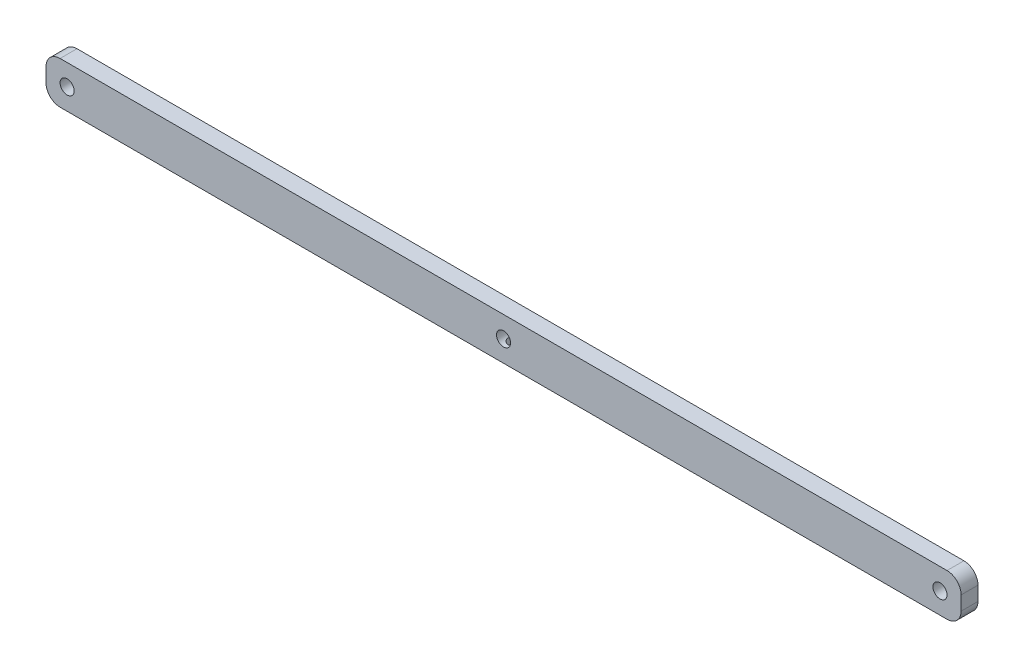
from build123d import *

# Parameters (mm, degrees)
SZKIC1_W                       = 325
SZKIC1_H                       = 15
SZKIC1_R                       = 2.5
DODANIE_WYCI_GNI_CIE1_DEPTH    = 3
ZAOKR_GLENIE1_R                = 5
OTWORY_USTALAJ_CE_3_0MM1_D     = 3
OTWORY_USTALAJ_CE_3_0MM1_DEPTH = 7.499
OTWORY_USTALAJ_CE_3_0MM1_TIP   = 0.901290929


with BuildPart() as part:
    # Szkic1 → Dodanie-wyciągnięcie1 (new, symmetric)
    with BuildSketch(Plane.XY):
        Rectangle(SZKIC1_W, SZKIC1_H)
        with Locations((155, 0)):
            Circle(SZKIC1_R, mode=Mode.SUBTRACT)
        with Locations((-155, 0)):
            Circle(SZKIC1_R, mode=Mode.SUBTRACT)
        Circle(SZKIC1_R, mode=Mode.SUBTRACT)
    extrude(amount=DODANIE_WYCI_GNI_CIE1_DEPTH, both=True)

    # Zaokrąglenie1
    zaokr_glenie1_edges = [part.edges().sort_by_distance(p)[0] for p in [
        (162.5, 7.5, 0),
        (162.5, -7.5, 0),
        (-162.5, -7.5, 0),
        (-162.5, 7.5, 0),
    ]]
    fillet(zaokr_glenie1_edges, radius=ZAOKR_GLENIE1_R)

    # Otwory ustalające Ø3.0mm1
    with Locations(Plane(origin=(0, -7.5, 0), x_dir=(-1, 0, 0), z_dir=(0, -1, 0))):
        with Locations((0, 0)):
            Hole(OTWORY_USTALAJ_CE_3_0MM1_D / 2, depth=OTWORY_USTALAJ_CE_3_0MM1_DEPTH)
            with Locations((0, 0, -(OTWORY_USTALAJ_CE_3_0MM1_DEPTH + OTWORY_USTALAJ_CE_3_0MM1_TIP / 2))):  # 118° drill point
                Cone(0, OTWORY_USTALAJ_CE_3_0MM1_D / 2, OTWORY_USTALAJ_CE_3_0MM1_TIP, mode=Mode.SUBTRACT)


solid = part.part
